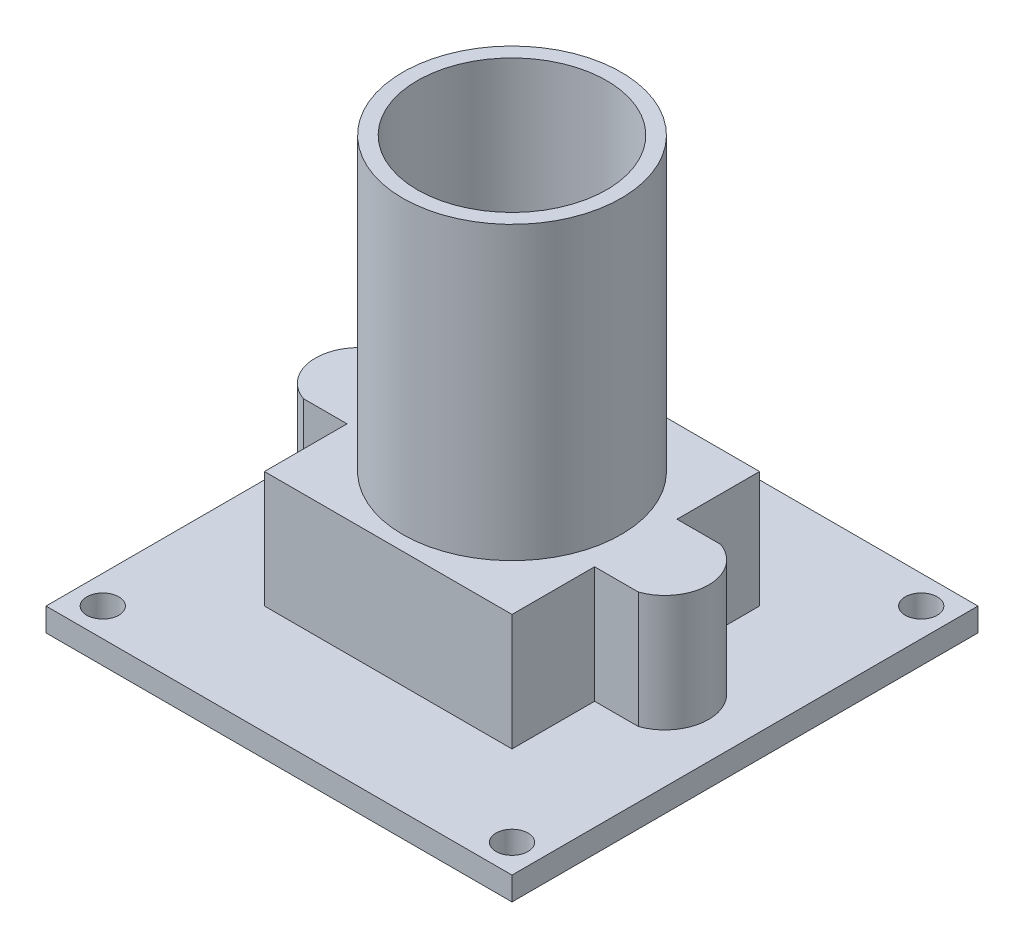
from build123d import *

# Parameters (mm, degrees)
SKETCH1_W            = 32
SKETCH1_H            = 32
PCB_THICKNESS_DEPTH  = 1.6
SKETCH2_W            = 17
SKETCH2_H            = 17
LENS_1_DEPTH         = 8
SKETCH3_R            = 7.5
LENS_2_DEPTH         = 20
LENS_3_DEPTH         = 8
SKETCH7_R            = 6.5
LENS_4_DEPTH         = 28
SKETCH5_R            = 1.1
MOUNTING_HOLES_DEPTH = 54.216538783


with BuildPart() as part:
    # Sketch1 → pcb_thickness (new body)
    with BuildSketch(Plane(origin=(0, 0, 0), x_dir=(1, 0, 0), z_dir=(0, 1, 0))):
        with Locations((-16, 16)):
            Rectangle(SKETCH1_W, SKETCH1_H)
    extrude(amount=PCB_THICKNESS_DEPTH)

    # Sketch2 → lens_1 (add)
    with BuildSketch(Plane(origin=(0, 1.6, 0), x_dir=(1, 0, 0), z_dir=(0, 1, 0))):
        with Locations((-16, 16)):
            Rectangle(SKETCH2_W, SKETCH2_H)
    extrude(amount=LENS_1_DEPTH)

    # Sketch3 → lens_2 (add)
    with BuildSketch(Plane(origin=(0, 9.6, 0), x_dir=(1, 0, 0), z_dir=(0, 1, 0))):
        with Locations(Location((-16, 16, 0), (0, 0, 270))):
            Circle(SKETCH3_R)
    extrude(amount=LENS_2_DEPTH)

    # Sketch6 → lens_3 (add)
    with BuildSketch(Plane(origin=(0, 1.6, 0), x_dir=(1, 0, 0), z_dir=(0, 1, 0))):
        with BuildLine():
            Line((-24.5, 18.828427125), (-27.5, 18.828427125))
            ThreePointArc((-27.5, 18.828427125), (-29.5, 16), (-27.5, 13.171572875))
            Line((-27.5, 13.171572875), (-24.5, 13.171572875))
            Line((-24.5, 13.171572875), (-24.5, 18.828427125))
        make_face()
        with BuildLine():
            Line((-7.5, 18.828427125), (-4.5, 18.828427125))
            ThreePointArc((-4.5, 18.828427125), (-2.5, 16), (-4.5, 13.171572875))
            Line((-4.5, 13.171572875), (-7.5, 13.171572875))
            Line((-7.5, 13.171572875), (-7.5, 18.828427125))
        make_face()
    extrude(amount=LENS_3_DEPTH)

    # Sketch7 → lens_4 (cut)
    with BuildSketch(Plane(origin=(0, 29.6, 0), x_dir=(1, 0, 0), z_dir=(0, 1, 0))):
        with Locations(Location((-16, 16, 0), (0, 0, 270))):
            Circle(SKETCH7_R)
    extrude(amount=-LENS_4_DEPTH, mode=Mode.SUBTRACT)

    # Sketch5 → mounting_holes (cut, through all)
    with BuildSketch(Plane(origin=(0, 1.6, 0), x_dir=(1, 0, 0), z_dir=(0, 1, 0))):
        with Locations(Location((-30.050000926, 30.050000926, 0), (0, 0, 270))):
            Circle(SKETCH5_R)
        with Locations(Location((-1.950000926, 30.049999074, 0), (0, 0, 270))):
            Circle(SKETCH5_R)
        with Locations(Location((-1.949999074, 1.949999074, 0), (0, 0, 270))):
            Circle(SKETCH5_R)
        with Locations(Location((-30.049999074, 1.950000926, 0), (0, 0, 270))):
            Circle(SKETCH5_R)
    extrude(amount=-MOUNTING_HOLES_DEPTH, mode=Mode.SUBTRACT)


solid = part.part
